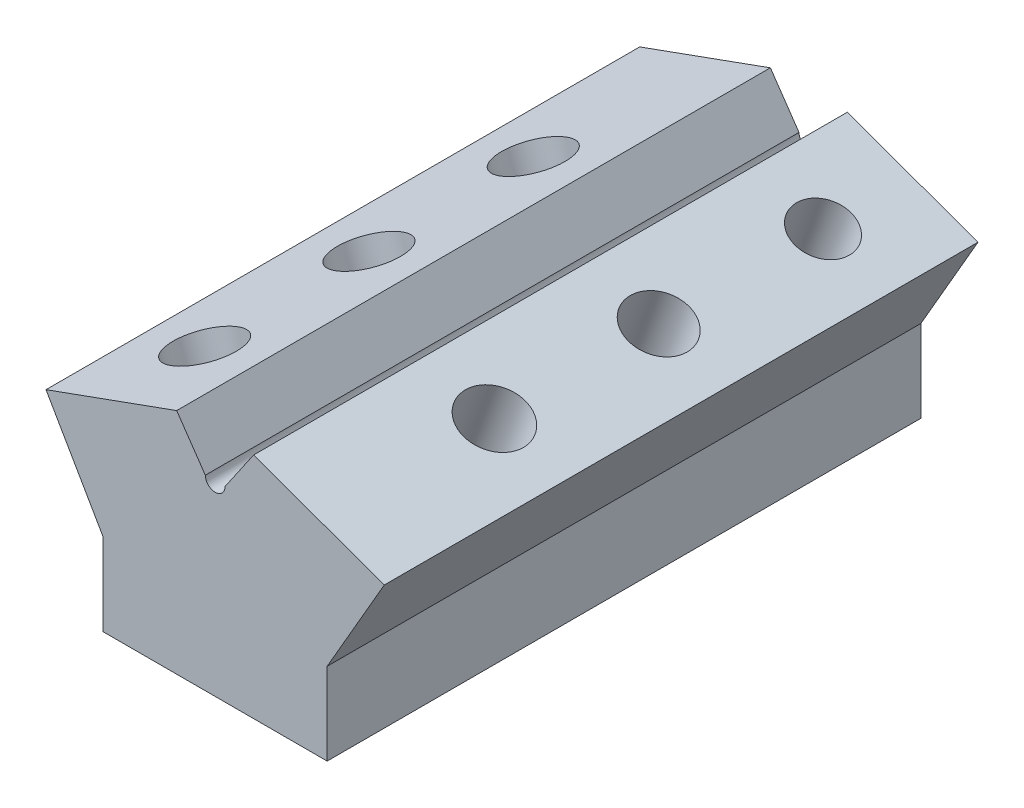
from build123d import *

# Parameters (mm, degrees)
BOSS_EXTRUDE1_DEPTH = 403.86
BOSS_EXTRUDE2_DEPTH = 403.86
CUT_EXTRUDE2_START  = 19.05
SKETCH3_R           = 19.091620187
SKETCH3_R_2         = 20.569967825
SKETCH3_R_3         = 20.984373032
CUT_EXTRUDE2_DEPTH  = 481.006463827
CUT_EXTRUDE3_START  = 19.05
SKETCH4_R           = 22.86
CUT_EXTRUDE3_DEPTH  = 481.006463827
CUT_EXTRUDE4_START  = 25.4
CUT_EXTRUDE4_DEPTH  = 353.06
SKETCH7_R           = 6.35
CUT_EXTRUDE8_DEPTH  = 76.2


with BuildPart() as part:
    # Sketch1 → Boss-Extrude1 (new body)
    with BuildSketch(Plane.XY):
        with BuildLine():
            Line((76.2, 0), (76.2, 55.88))
            Line((76.2, 55.88), (115.061446619, 123.19))
            Line((115.061446619, 123.19), (26.161446619, 155.326122142))
            Line((26.161446619, 155.326122142), (6.688356563, 127))
            ThreePointArc((6.688356563, 127), (0, 120.311643437), (-6.688356563, 127))
            Line((-6.688356563, 127), (-26.161446619, 155.326122142))
            Line((-26.161446619, 155.326122142), (-115.061446619, 123.19))
            Line((-115.061446619, 123.19), (-76.2, 55.88))
            Line((-76.2, 55.88), (-76.2, 0))
            Line((-76.2, 0), (76.2, 0))
        make_face()
    extrude(amount=BOSS_EXTRUDE1_DEPTH)

    # Sketch1<2> → Boss-Extrude2 (add)
    with BuildSketch(Plane.XY):
        with BuildLine():
            Line((76.2, 0), (76.2, 55.88))
            Line((76.2, 55.88), (115.061446619, 123.19))
            Line((115.061446619, 123.19), (26.161446619, 155.326122142))
            Line((26.161446619, 155.326122142), (6.688356563, 127))
            ThreePointArc((6.688356563, 127), (0, 120.311643437), (-6.688356563, 127))
            Line((-6.688356563, 127), (-26.161446619, 155.326122142))
            Line((-26.161446619, 155.326122142), (-115.061446619, 123.19))
            Line((-115.061446619, 123.19), (-76.2, 55.88))
            Line((-76.2, 55.88), (-76.2, 0))
            Line((-76.2, 0), (76.2, 0))
        make_face()
    extrude(amount=BOSS_EXTRUDE2_DEPTH)

    # Sketch3 → Cut-Extrude2 (cut, through all)
    with BuildSketch(Plane(origin=(52.682660739, 145.73906954, 0), x_dir=(0.9404411643717996, -0.3399564918559638, 0), z_dir=(0.33995649185596377, 0.9404411643717995, 0)).offset(CUT_EXTRUDE2_START)):
        with Locations((19.043177743, -60.96)):
            Circle(SKETCH3_R)
        with Locations((19.043177743, -172.72)):
            Circle(SKETCH3_R_2)
        with Locations((19.043177743, -284.48)):
            Circle(SKETCH3_R_3)
    extrude(amount=-CUT_EXTRUDE2_DEPTH, mode=Mode.SUBTRACT)

    # Sketch4 → Cut-Extrude3 (cut, through all)
    with BuildSketch(Plane(origin=(-52.682660739, 145.73906954, 0), x_dir=(0.9404411643717996, 0.3399564918559638, 0), z_dir=(-0.33995649185596377, 0.9404411643717995, 0)).offset(CUT_EXTRUDE3_START)):
        with Locations((-19.085280601, -116.840003489)):
            Circle(SKETCH4_R)
        with Locations((-19.085280601, -228.600003489)):
            Circle(SKETCH4_R)
        with Locations((-19.085280601, -340.360003489)):
            Circle(SKETCH4_R)
    extrude(amount=-CUT_EXTRUDE3_DEPTH, mode=Mode.SUBTRACT)

    # Sketch6 → Cut-Extrude4 (cut)
    with BuildSketch(Plane.XY.offset(CUT_EXTRUDE4_START)):
        with BuildLine():
            Line((50.811289955, 0), (-50.811289955, 0))
            Line((-50.811289955, 0), (-50.811289955, 31.75))
            Line((-50.811289955, 31.75), (-26.302401749, 45.819252354))
            ThreePointArc((-26.302401749, 45.819252354), (0, 52.832), (26.302401749, 45.819252354))
            Line((26.302401749, 45.819252354), (50.811289955, 31.75))
            Line((50.811289955, 31.75), (50.811289955, 0))
        make_face()
    extrude(amount=CUT_EXTRUDE4_DEPTH, mode=Mode.SUBTRACT)

    # Sketch7 → Cut-Extrude8 (cut)
    with BuildSketch(Plane.XZ):
        with Locations((-63.5, 391.16)):
            Circle(SKETCH7_R)
        with Locations((63.5, 12.7)):
            Circle(SKETCH7_R)
    extrude(amount=-CUT_EXTRUDE8_DEPTH, mode=Mode.SUBTRACT)


solid = part.part
